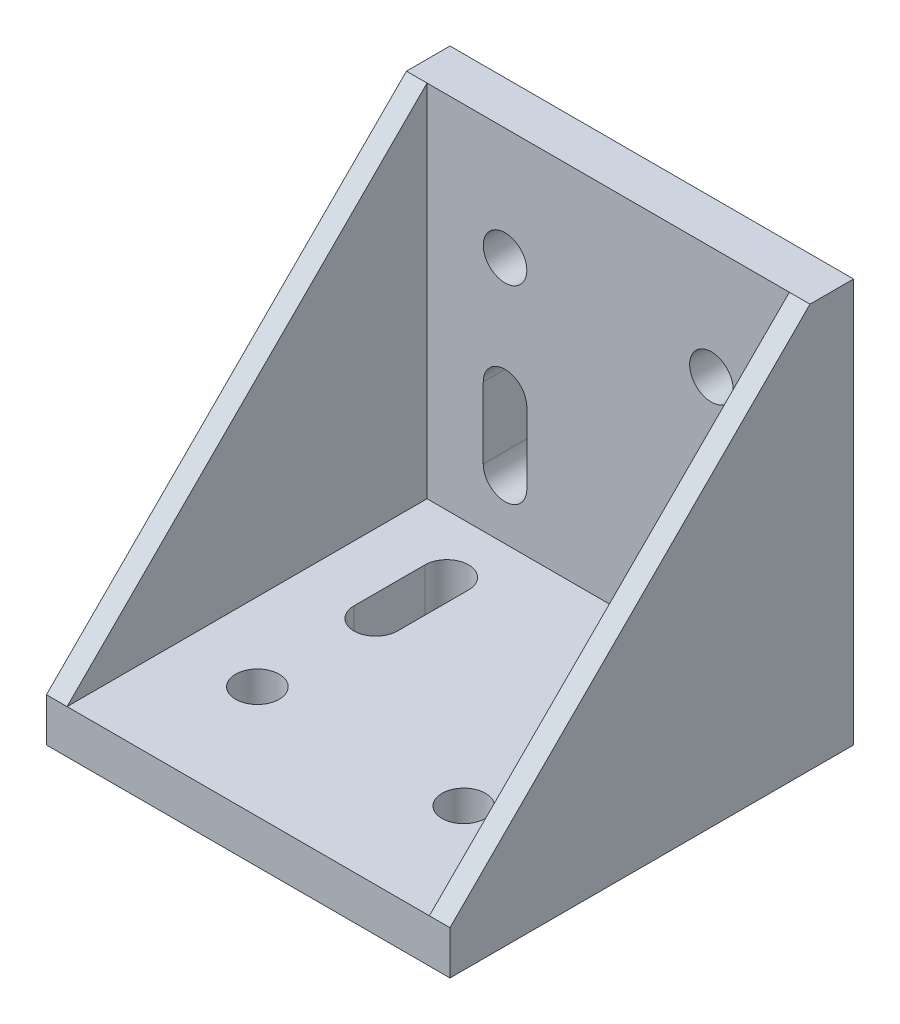
from build123d import *

# Parameters (mm, degrees)
SKETCH_1_W          = 88
SKETCH_1_H          = 88
EXTRUDE_1_DEPTH     = 9.5
SKETCH_2_W          = 88
SKETCH_2_H          = 9.5
EXTRUDE_2_DEPTH     = 88
EXTRUDE_3_DEPTH     = 4.5
SKETCH_4_R          = 4.75
CUT_EXTRUDE_1_DEPTH = 126.866000175


with BuildPart() as part:
    # 草图1 → 凸台-拉伸1 (new body)
    with BuildSketch(Plane.XY):
        Rectangle(SKETCH_1_W, SKETCH_1_H)
    extrude(amount=EXTRUDE_1_DEPTH)

    # 草图2 → 凸台-拉伸2 (add)
    with BuildSketch(Plane(origin=(0, 0, 0), x_dir=(-1, 0, 0), z_dir=(0, 0, -1))):
        with Locations((0, -39.25)):
            Rectangle(SKETCH_2_W, SKETCH_2_H)
    extrude(amount=-EXTRUDE_2_DEPTH)

    # 草图3 → 凸台-拉伸3 (add)
    with BuildSketch(Plane.ZY.offset(44)):
        Polygon((9.5, 44), (88, -34.5), (9.5, -34.5), align=None)
    extrude_3 = extrude(amount=-EXTRUDE_3_DEPTH)

    # 镜向1: 凸台-拉伸3 across plane
    add(extrude_3.mirror(Plane(origin=(0, 0, 0), x_dir=(0, 0, 1), z_dir=(1, 0, 0))))

    # 草图4 → 切除-拉伸1 (cut, through all)
    with BuildSketch(Plane(origin=(0, -34.5, 0), x_dir=(1, 0, 0), z_dir=(0, 1, 0))):
        with Locations(Location((22.5, -63.5, 0), (0, 0, 270))):
            Circle(SKETCH_4_R)
        with Locations(Location((-22.5, -63.5, 0), (0, 0, 90))):
            Circle(SKETCH_4_R)
        with BuildLine():
            Line((17.75, -37.7), (17.75, -22.2))
            ThreePointArc((17.75, -22.2), (22.5, -17.45), (27.25, -22.2))
            Line((27.25, -22.2), (27.25, -37.7))
            ThreePointArc((27.25, -37.7), (22.5, -42.45), (17.75, -37.7))
        make_face()
        with BuildLine():
            Line((-17.75, -37.7), (-17.75, -22.2))
            ThreePointArc((-17.75, -22.2), (-22.5, -17.45), (-27.25, -22.2))
            Line((-27.25, -22.2), (-27.25, -37.7))
            ThreePointArc((-27.25, -37.7), (-22.5, -42.45), (-17.75, -37.7))
        make_face()
    cut_extrude_1 = extrude(amount=-CUT_EXTRUDE_1_DEPTH, mode=Mode.SUBTRACT)

    # 镜向2: 切除-拉伸1 across plane
    add(cut_extrude_1.mirror(Plane(origin=(0, -22, 22), x_dir=(0, 0.7071067811865476, 0.7071067811865476), z_dir=(0, -0.7071067811865477, 0.7071067811865475))), mode=Mode.SUBTRACT)


solid = part.part
